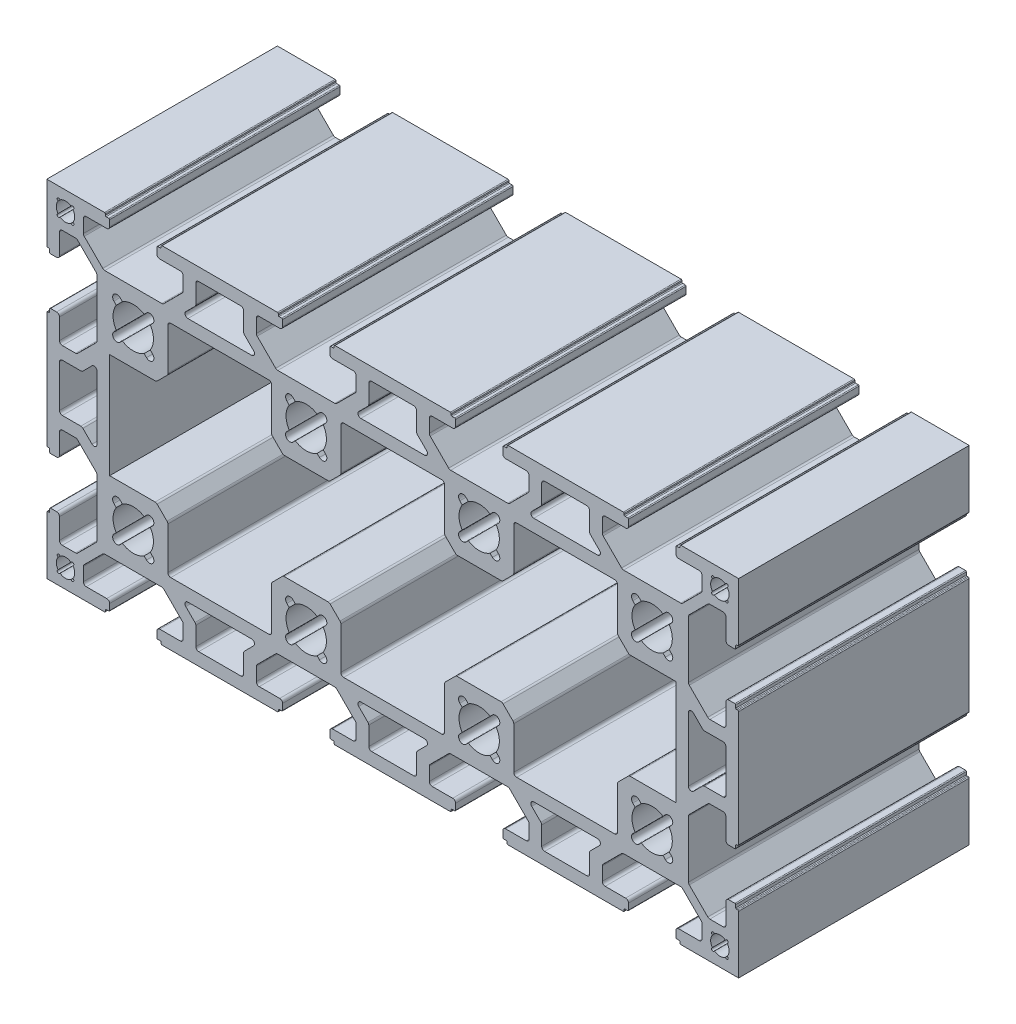
from build123d import *

# Parameters (mm, degrees)
Y_KSEKLIK_EKSTR_ZYON1_DEPTH = 40


with BuildPart() as part:
    # Çizim3 → Yükseklik-Ekstrüzyon1 (new body)
    with BuildSketch(Plane.XY):
        with BuildLine():
            Line((-10.9, 28.3), (-10.9, 29.35))
            ThreePointArc((-10.9, 29.35), (-10.856066017, 29.456066017), (-10.75, 29.5))
            Line((-10.75, 29.5), (-10.3, 29.5))
            ThreePointArc((-10.3, 29.5), (-10.193933983, 29.543933983), (-10.15, 29.65))
            Line((-10.15, 29.65), (-10.15, 29.85))
            ThreePointArc((-10.15, 29.85), (-10.106066017, 29.956066017), (-10, 30))
            Line((-10, 30), (10, 30))
            ThreePointArc((10, 30), (10.106066017, 29.956066017), (10.15, 29.85))
            Line((10.15, 29.85), (10.15, 29.65))
            ThreePointArc((10.15, 29.65), (10.193933983, 29.543933983), (10.3, 29.5))
            Line((10.3, 29.5), (10.75, 29.5))
            ThreePointArc((10.75, 29.5), (10.856066017, 29.456066017), (10.9, 29.35))
            Line((10.9, 29.35), (10.9, 28.3))
            ThreePointArc((10.9, 28.3), (10.753553391, 27.946446609), (10.4, 27.8))
            Line((10.4, 27.8), (6.85, 27.8))
            ThreePointArc((6.85, 27.8), (6.496446609, 27.653553391), (6.35, 27.3))
            Line((6.35, 27.3), (6.35, 25.007106781))
            ThreePointArc((6.35, 25.007106781), (6.388060234, 24.815765065), (6.496446609, 24.653553391))
            Line((6.496446609, 24.653553391), (9.703553391, 21.446446609))
            ThreePointArc((9.703553391, 21.446446609), (9.865765065, 21.338060234), (10.057106781, 21.3))
            Line((10.057106781, 21.3), (19.942893219, 21.3))
            ThreePointArc((19.942893219, 21.3), (20.134234935, 21.338060234), (20.296446609, 21.446446609))
            Line((20.296446609, 21.446446609), (23.503553391, 24.653553391))
            ThreePointArc((23.503553391, 24.653553391), (23.611939766, 24.815765065), (23.65, 25.007106781))
            Line((23.65, 25.007106781), (23.65, 27.3))
            ThreePointArc((23.65, 27.3), (23.503553391, 27.653553391), (23.15, 27.8))
            Line((23.15, 27.8), (19.6, 27.8))
            ThreePointArc((19.6, 27.8), (19.246446609, 27.946446609), (19.1, 28.3))
            Line((19.1, 28.3), (19.1, 29.35))
            ThreePointArc((19.1, 29.35), (19.143933983, 29.456066017), (19.25, 29.5))
            Line((19.25, 29.5), (19.7, 29.5))
            ThreePointArc((19.7, 29.5), (19.806066017, 29.543933983), (19.85, 29.65))
            Line((19.85, 29.65), (19.85, 29.85))
            ThreePointArc((19.85, 29.85), (19.893933983, 29.956066017), (20, 30))
            Line((20, 30), (40, 30))
            ThreePointArc((40, 30), (40.106066017, 29.956066017), (40.15, 29.85))
            Line((40.15, 29.85), (40.15, 29.65))
            ThreePointArc((40.15, 29.65), (40.193933983, 29.543933983), (40.3, 29.5))
            Line((40.3, 29.5), (40.75, 29.5))
            ThreePointArc((40.75, 29.5), (40.856066017, 29.456066017), (40.9, 29.35))
            Line((40.9, 29.35), (40.9, 28.3))
            ThreePointArc((40.9, 28.3), (40.753553391, 27.946446609), (40.4, 27.8))
            Line((40.4, 27.8), (36.85, 27.8))
            ThreePointArc((36.85, 27.8), (36.496446609, 27.653553391), (36.35, 27.3))
            Line((36.35, 27.3), (36.35, 25.007106781))
            ThreePointArc((36.35, 25.007106781), (36.388060234, 24.815765065), (36.496446609, 24.653553391))
            Line((36.496446609, 24.653553391), (39.703553391, 21.446446609))
            ThreePointArc((39.703553391, 21.446446609), (39.865765065, 21.338060234), (40.057106781, 21.3))
            Line((40.057106781, 21.3), (49.942893219, 21.3))
            ThreePointArc((49.942893219, 21.3), (50.134234935, 21.338060234), (50.296446609, 21.446446609))
            Line((50.296446609, 21.446446609), (53.503553391, 24.653553391))
            ThreePointArc((53.503553391, 24.653553391), (53.611939766, 24.815765065), (53.65, 25.007106781))
            Line((53.65, 25.007106781), (53.65, 27.3))
            ThreePointArc((53.65, 27.3), (53.503553391, 27.653553391), (53.15, 27.8))
            Line((53.15, 27.8), (49.6, 27.8))
            ThreePointArc((49.6, 27.8), (49.246446609, 27.946446609), (49.1, 28.3))
            Line((49.1, 28.3), (49.1, 29.35))
            ThreePointArc((49.1, 29.35), (49.143933983, 29.456066017), (49.25, 29.5))
            Line((49.25, 29.5), (49.7, 29.5))
            ThreePointArc((49.7, 29.5), (49.806066017, 29.543933983), (49.85, 29.65))
            Line((49.85, 29.65), (49.85, 29.85))
            ThreePointArc((49.85, 29.85), (49.893933983, 29.956066017), (50, 30))
            Line((50, 30), (60, 30))
            Line((60, 30), (60, 20))
            ThreePointArc((60, 20), (59.956066017, 19.893933983), (59.85, 19.85))
            Line((59.85, 19.85), (59.65, 19.85))
            ThreePointArc((59.65, 19.85), (59.543933983, 19.806066017), (59.5, 19.7))
            Line((59.5, 19.7), (59.5, 19.25))
            ThreePointArc((59.5, 19.25), (59.456066017, 19.143933983), (59.35, 19.1))
            Line((59.35, 19.1), (58.3, 19.1))
            ThreePointArc((58.3, 19.1), (57.946446609, 19.246446609), (57.8, 19.6))
            Line((57.8, 19.6), (57.8, 23.15))
            ThreePointArc((57.8, 23.15), (57.653553391, 23.503553391), (57.3, 23.65))
            Line((57.3, 23.65), (55.007106781, 23.65))
            ThreePointArc((55.007106781, 23.65), (54.815765065, 23.611939766), (54.653553391, 23.503553391))
            Line((54.653553391, 23.503553391), (51.446446609, 20.296446609))
            ThreePointArc((51.446446609, 20.296446609), (51.338060234, 20.134234935), (51.3, 19.942893219))
            Line((51.3, 19.942893219), (51.3, 10.057106781))
            ThreePointArc((51.3, 10.057106781), (51.338060234, 9.865765065), (51.446446609, 9.703553391))
            Line((51.446446609, 9.703553391), (54.653553391, 6.496446609))
            ThreePointArc((54.653553391, 6.496446609), (54.815765065, 6.388060234), (55.007106781, 6.35))
            Line((55.007106781, 6.35), (57.3, 6.35))
            ThreePointArc((57.3, 6.35), (57.653553391, 6.496446609), (57.8, 6.85))
            Line((57.8, 6.85), (57.8, 10.4))
            ThreePointArc((57.8, 10.4), (57.946446609, 10.753553391), (58.3, 10.9))
            Line((58.3, 10.9), (59.35, 10.9))
            ThreePointArc((59.35, 10.9), (59.456066017, 10.856066017), (59.5, 10.75))
            Line((59.5, 10.75), (59.5, 10.3))
            ThreePointArc((59.5, 10.3), (59.543933983, 10.193933983), (59.65, 10.15))
            Line((59.65, 10.15), (59.85, 10.15))
            ThreePointArc((59.85, 10.15), (59.956066017, 10.106066017), (60, 10))
            Line((60, 10), (60, -10))
            ThreePointArc((60, -10), (59.956066017, -10.106066017), (59.85, -10.15))
            Line((59.85, -10.15), (59.65, -10.15))
            ThreePointArc((59.65, -10.15), (59.543933983, -10.193933983), (59.5, -10.3))
            Line((59.5, -10.3), (59.5, -10.75))
            ThreePointArc((59.5, -10.75), (59.456066017, -10.856066017), (59.35, -10.9))
            Line((59.35, -10.9), (58.3, -10.9))
            ThreePointArc((58.3, -10.9), (57.946446609, -10.753553391), (57.8, -10.4))
            Line((57.8, -10.4), (57.8, -6.85))
            ThreePointArc((57.8, -6.85), (57.653553391, -6.496446609), (57.3, -6.35))
            Line((57.3, -6.35), (55.007106781, -6.35))
            ThreePointArc((55.007106781, -6.35), (54.815765065, -6.388060234), (54.653553391, -6.496446609))
            Line((54.653553391, -6.496446609), (51.446446609, -9.703553391))
            ThreePointArc((51.446446609, -9.703553391), (51.338060234, -9.865765065), (51.3, -10.057106781))
            Line((51.3, -10.057106781), (51.3, -19.942893219))
            ThreePointArc((51.3, -19.942893219), (51.338060234, -20.134234935), (51.446446609, -20.296446609))
            Line((51.446446609, -20.296446609), (54.653553391, -23.503553391))
            ThreePointArc((54.653553391, -23.503553391), (54.815765065, -23.611939766), (55.007106781, -23.65))
            Line((55.007106781, -23.65), (57.3, -23.65))
            ThreePointArc((57.3, -23.65), (57.653553391, -23.503553391), (57.8, -23.15))
            Line((57.8, -23.15), (57.8, -19.6))
            ThreePointArc((57.8, -19.6), (57.946446609, -19.246446609), (58.3, -19.1))
            Line((58.3, -19.1), (59.35, -19.1))
            ThreePointArc((59.35, -19.1), (59.456066017, -19.143933983), (59.5, -19.25))
            Line((59.5, -19.25), (59.5, -19.7))
            ThreePointArc((59.5, -19.7), (59.543933983, -19.806066017), (59.65, -19.85))
            Line((59.65, -19.85), (59.85, -19.85))
            ThreePointArc((59.85, -19.85), (59.956066017, -19.893933983), (60, -20))
            Line((60, -20), (60, -30))
            Line((60, -30), (50, -30))
            ThreePointArc((50, -30), (49.893933983, -29.956066017), (49.85, -29.85))
            Line((49.85, -29.85), (49.85, -29.65))
            ThreePointArc((49.85, -29.65), (49.806066017, -29.543933983), (49.7, -29.5))
            Line((49.7, -29.5), (49.25, -29.5))
            ThreePointArc((49.25, -29.5), (49.143933983, -29.456066017), (49.1, -29.35))
            Line((49.1, -29.35), (49.1, -28.3))
            ThreePointArc((49.1, -28.3), (49.246446609, -27.946446609), (49.6, -27.8))
            Line((49.6, -27.8), (53.15, -27.8))
            ThreePointArc((53.15, -27.8), (53.503553391, -27.653553391), (53.65, -27.3))
            Line((53.65, -27.3), (53.65, -25.007106781))
            ThreePointArc((53.65, -25.007106781), (53.611939766, -24.815765065), (53.503553391, -24.653553391))
            Line((53.503553391, -24.653553391), (50.296446609, -21.446446609))
            ThreePointArc((50.296446609, -21.446446609), (50.134234935, -21.338060234), (49.942893219, -21.3))
            Line((49.942893219, -21.3), (40.057106781, -21.3))
            ThreePointArc((40.057106781, -21.3), (39.865765065, -21.338060234), (39.703553391, -21.446446609))
            Line((39.703553391, -21.446446609), (36.496446609, -24.653553391))
            ThreePointArc((36.496446609, -24.653553391), (36.388060234, -24.815765065), (36.35, -25.007106781))
            Line((36.35, -25.007106781), (36.35, -27.3))
            ThreePointArc((36.35, -27.3), (36.496446609, -27.653553391), (36.85, -27.8))
            Line((36.85, -27.8), (40.4, -27.8))
            ThreePointArc((40.4, -27.8), (40.753553391, -27.946446609), (40.9, -28.3))
            Line((40.9, -28.3), (40.9, -29.35))
            ThreePointArc((40.9, -29.35), (40.856066017, -29.456066017), (40.75, -29.5))
            Line((40.75, -29.5), (40.3, -29.5))
            ThreePointArc((40.3, -29.5), (40.193933983, -29.543933983), (40.15, -29.65))
            Line((40.15, -29.65), (40.15, -29.85))
            ThreePointArc((40.15, -29.85), (40.106066017, -29.956066017), (40, -30))
            Line((40, -30), (20, -30))
            ThreePointArc((20, -30), (19.893933983, -29.956066017), (19.85, -29.85))
            Line((19.85, -29.85), (19.85, -29.65))
            ThreePointArc((19.85, -29.65), (19.806066017, -29.543933983), (19.7, -29.5))
            Line((19.7, -29.5), (19.25, -29.5))
            ThreePointArc((19.25, -29.5), (19.143933983, -29.456066017), (19.1, -29.35))
            Line((19.1, -29.35), (19.1, -28.3))
            ThreePointArc((19.1, -28.3), (19.246446609, -27.946446609), (19.6, -27.8))
            Line((19.6, -27.8), (23.15, -27.8))
            ThreePointArc((23.15, -27.8), (23.503553391, -27.653553391), (23.65, -27.3))
            Line((23.65, -27.3), (23.65, -25.007106781))
            ThreePointArc((23.65, -25.007106781), (23.611939766, -24.815765065), (23.503553391, -24.653553391))
            Line((23.503553391, -24.653553391), (20.296446609, -21.446446609))
            ThreePointArc((20.296446609, -21.446446609), (20.134234935, -21.338060234), (19.942893219, -21.3))
            Line((19.942893219, -21.3), (10.057106781, -21.3))
            ThreePointArc((10.057106781, -21.3), (9.865765065, -21.338060234), (9.703553391, -21.446446609))
            Line((9.703553391, -21.446446609), (6.496446609, -24.653553391))
            ThreePointArc((6.496446609, -24.653553391), (6.388060234, -24.815765065), (6.35, -25.007106781))
            Line((6.35, -25.007106781), (6.35, -27.3))
            ThreePointArc((6.35, -27.3), (6.496446609, -27.653553391), (6.85, -27.8))
            Line((6.85, -27.8), (10.4, -27.8))
            ThreePointArc((10.4, -27.8), (10.753553391, -27.946446609), (10.9, -28.3))
            Line((10.9, -28.3), (10.9, -29.35))
            ThreePointArc((10.9, -29.35), (10.856066017, -29.456066017), (10.75, -29.5))
            Line((10.75, -29.5), (10.3, -29.5))
            ThreePointArc((10.3, -29.5), (10.193933983, -29.543933983), (10.15, -29.65))
            Line((10.15, -29.65), (10.15, -29.85))
            ThreePointArc((10.15, -29.85), (10.106066017, -29.956066017), (10, -30))
            Line((10, -30), (-10, -30))
            ThreePointArc((-10, -30), (-10.106066017, -29.956066017), (-10.15, -29.85))
            Line((-10.15, -29.85), (-10.15, -29.65))
            ThreePointArc((-10.15, -29.65), (-10.193933983, -29.543933983), (-10.3, -29.5))
            Line((-10.3, -29.5), (-10.75, -29.5))
            ThreePointArc((-10.75, -29.5), (-10.856066017, -29.456066017), (-10.9, -29.35))
            Line((-10.9, -29.35), (-10.9, -28.3))
            ThreePointArc((-10.9, -28.3), (-10.753553391, -27.946446609), (-10.4, -27.8))
            Line((-10.4, -27.8), (-6.85, -27.8))
            ThreePointArc((-6.85, -27.8), (-6.496446609, -27.653553391), (-6.35, -27.3))
            Line((-6.35, -27.3), (-6.35, -25.007106781))
            ThreePointArc((-6.35, -25.007106781), (-6.388060234, -24.815765065), (-6.496446609, -24.653553391))
            Line((-6.496446609, -24.653553391), (-9.703553391, -21.446446609))
            ThreePointArc((-9.703553391, -21.446446609), (-9.865765065, -21.338060234), (-10.057106781, -21.3))
            Line((-10.057106781, -21.3), (-19.942893219, -21.3))
            ThreePointArc((-19.942893219, -21.3), (-20.134234935, -21.338060234), (-20.296446609, -21.446446609))
            Line((-20.296446609, -21.446446609), (-23.503553391, -24.653553391))
            ThreePointArc((-23.503553391, -24.653553391), (-23.611939766, -24.815765065), (-23.65, -25.007106781))
            Line((-23.65, -25.007106781), (-23.65, -27.3))
            ThreePointArc((-23.65, -27.3), (-23.503553391, -27.653553391), (-23.15, -27.8))
            Line((-23.15, -27.8), (-19.6, -27.8))
            ThreePointArc((-19.6, -27.8), (-19.246446609, -27.946446609), (-19.1, -28.3))
            Line((-19.1, -28.3), (-19.1, -29.35))
            ThreePointArc((-19.1, -29.35), (-19.143933983, -29.456066017), (-19.25, -29.5))
            Line((-19.25, -29.5), (-19.7, -29.5))
            ThreePointArc((-19.7, -29.5), (-19.806066017, -29.543933983), (-19.85, -29.65))
            Line((-19.85, -29.65), (-19.85, -29.85))
            ThreePointArc((-19.85, -29.85), (-19.893933983, -29.956066017), (-20, -30))
            Line((-20, -30), (-40, -30))
            ThreePointArc((-40, -30), (-40.106066017, -29.956066017), (-40.15, -29.85))
            Line((-40.15, -29.85), (-40.15, -29.65))
            ThreePointArc((-40.15, -29.65), (-40.193933983, -29.543933983), (-40.3, -29.5))
            Line((-40.3, -29.5), (-40.75, -29.5))
            ThreePointArc((-40.75, -29.5), (-40.856066017, -29.456066017), (-40.9, -29.35))
            Line((-40.9, -29.35), (-40.9, -28.3))
            ThreePointArc((-40.9, -28.3), (-40.753553391, -27.946446609), (-40.4, -27.8))
            Line((-40.4, -27.8), (-36.85, -27.8))
            ThreePointArc((-36.85, -27.8), (-36.496446609, -27.653553391), (-36.35, -27.3))
            Line((-36.35, -27.3), (-36.35, -25.007106781))
            ThreePointArc((-36.35, -25.007106781), (-36.388060234, -24.815765065), (-36.496446609, -24.653553391))
            Line((-36.496446609, -24.653553391), (-39.703553391, -21.446446609))
            ThreePointArc((-39.703553391, -21.446446609), (-39.865765065, -21.338060234), (-40.057106781, -21.3))
            Line((-40.057106781, -21.3), (-49.942893219, -21.3))
            ThreePointArc((-49.942893219, -21.3), (-50.134234935, -21.338060234), (-50.296446609, -21.446446609))
            Line((-50.296446609, -21.446446609), (-53.503553391, -24.653553391))
            ThreePointArc((-53.503553391, -24.653553391), (-53.611939766, -24.815765065), (-53.65, -25.007106781))
            Line((-53.65, -25.007106781), (-53.65, -27.3))
            ThreePointArc((-53.65, -27.3), (-53.503553391, -27.653553391), (-53.15, -27.8))
            Line((-53.15, -27.8), (-49.6, -27.8))
            ThreePointArc((-49.6, -27.8), (-49.246446609, -27.946446609), (-49.1, -28.3))
            Line((-49.1, -28.3), (-49.1, -29.35))
            ThreePointArc((-49.1, -29.35), (-49.143933983, -29.456066017), (-49.25, -29.5))
            Line((-49.25, -29.5), (-49.7, -29.5))
            ThreePointArc((-49.7, -29.5), (-49.806066017, -29.543933983), (-49.85, -29.65))
            Line((-49.85, -29.65), (-49.85, -29.85))
            ThreePointArc((-49.85, -29.85), (-49.893933983, -29.956066017), (-50, -30))
            Line((-50, -30), (-60, -30))
            Line((-60, -30), (-60, -20))
            ThreePointArc((-60, -20), (-59.956066017, -19.893933983), (-59.85, -19.85))
            Line((-59.85, -19.85), (-59.65, -19.85))
            ThreePointArc((-59.65, -19.85), (-59.543933983, -19.806066017), (-59.5, -19.7))
            Line((-59.5, -19.7), (-59.5, -19.25))
            ThreePointArc((-59.5, -19.25), (-59.456066017, -19.143933983), (-59.35, -19.1))
            Line((-59.35, -19.1), (-58.3, -19.1))
            ThreePointArc((-58.3, -19.1), (-57.946446609, -19.246446609), (-57.8, -19.6))
            Line((-57.8, -19.6), (-57.8, -23.15))
            ThreePointArc((-57.8, -23.15), (-57.653553391, -23.503553391), (-57.3, -23.65))
            Line((-57.3, -23.65), (-55.007106781, -23.65))
            ThreePointArc((-55.007106781, -23.65), (-54.815765065, -23.611939766), (-54.653553391, -23.503553391))
            Line((-54.653553391, -23.503553391), (-51.446446609, -20.296446609))
            ThreePointArc((-51.446446609, -20.296446609), (-51.338060234, -20.134234935), (-51.3, -19.942893219))
            Line((-51.3, -19.942893219), (-51.3, -10.057106781))
            ThreePointArc((-51.3, -10.057106781), (-51.338060234, -9.865765065), (-51.446446609, -9.703553391))
            Line((-51.446446609, -9.703553391), (-54.653553391, -6.496446609))
            ThreePointArc((-54.653553391, -6.496446609), (-54.815765065, -6.388060234), (-55.007106781, -6.35))
            Line((-55.007106781, -6.35), (-57.3, -6.35))
            ThreePointArc((-57.3, -6.35), (-57.653553391, -6.496446609), (-57.8, -6.85))
            Line((-57.8, -6.85), (-57.8, -10.4))
            ThreePointArc((-57.8, -10.4), (-57.946446609, -10.753553391), (-58.3, -10.9))
            Line((-58.3, -10.9), (-59.35, -10.9))
            ThreePointArc((-59.35, -10.9), (-59.456066017, -10.856066017), (-59.5, -10.75))
            Line((-59.5, -10.75), (-59.5, -10.3))
            ThreePointArc((-59.5, -10.3), (-59.543933983, -10.193933983), (-59.65, -10.15))
            Line((-59.65, -10.15), (-59.85, -10.15))
            ThreePointArc((-59.85, -10.15), (-59.956066017, -10.106066017), (-60, -10))
            Line((-60, -10), (-60, 10))
            ThreePointArc((-60, 10), (-59.956066017, 10.106066017), (-59.85, 10.15))
            Line((-59.85, 10.15), (-59.65, 10.15))
            ThreePointArc((-59.65, 10.15), (-59.543933983, 10.193933983), (-59.5, 10.3))
            Line((-59.5, 10.3), (-59.5, 10.75))
            ThreePointArc((-59.5, 10.75), (-59.456066017, 10.856066017), (-59.35, 10.9))
            Line((-59.35, 10.9), (-58.3, 10.9))
            ThreePointArc((-58.3, 10.9), (-57.946446609, 10.753553391), (-57.8, 10.4))
            Line((-57.8, 10.4), (-57.8, 6.85))
            ThreePointArc((-57.8, 6.85), (-57.653553391, 6.496446609), (-57.3, 6.35))
            Line((-57.3, 6.35), (-55.007106781, 6.35))
            ThreePointArc((-55.007106781, 6.35), (-54.815765065, 6.388060234), (-54.653553391, 6.496446609))
            Line((-54.653553391, 6.496446609), (-51.446446609, 9.703553391))
            ThreePointArc((-51.446446609, 9.703553391), (-51.338060234, 9.865765065), (-51.3, 10.057106781))
            Line((-51.3, 10.057106781), (-51.3, 19.942893219))
            ThreePointArc((-51.3, 19.942893219), (-51.338060234, 20.134234935), (-51.446446609, 20.296446609))
            Line((-51.446446609, 20.296446609), (-54.653553391, 23.503553391))
            ThreePointArc((-54.653553391, 23.503553391), (-54.815765065, 23.611939766), (-55.007106781, 23.65))
            Line((-55.007106781, 23.65), (-57.3, 23.65))
            ThreePointArc((-57.3, 23.65), (-57.653553391, 23.503553391), (-57.8, 23.15))
            Line((-57.8, 23.15), (-57.8, 19.6))
            ThreePointArc((-57.8, 19.6), (-57.946446609, 19.246446609), (-58.3, 19.1))
            Line((-58.3, 19.1), (-59.35, 19.1))
            ThreePointArc((-59.35, 19.1), (-59.456066017, 19.143933983), (-59.5, 19.25))
            Line((-59.5, 19.25), (-59.5, 19.7))
            ThreePointArc((-59.5, 19.7), (-59.543933983, 19.806066017), (-59.65, 19.85))
            Line((-59.65, 19.85), (-59.85, 19.85))
            ThreePointArc((-59.85, 19.85), (-59.956066017, 19.893933983), (-60, 20))
            Line((-60, 20), (-60, 30))
            Line((-60, 30), (-50, 30))
            ThreePointArc((-50, 30), (-49.893933983, 29.956066017), (-49.85, 29.85))
            Line((-49.85, 29.85), (-49.85, 29.65))
            ThreePointArc((-49.85, 29.65), (-49.806066017, 29.543933983), (-49.7, 29.5))
            Line((-49.7, 29.5), (-49.25, 29.5))
            ThreePointArc((-49.25, 29.5), (-49.143933983, 29.456066017), (-49.1, 29.35))
            Line((-49.1, 29.35), (-49.1, 28.3))
            ThreePointArc((-49.1, 28.3), (-49.246446609, 27.946446609), (-49.6, 27.8))
            Line((-49.6, 27.8), (-53.15, 27.8))
            ThreePointArc((-53.15, 27.8), (-53.503553391, 27.653553391), (-53.65, 27.3))
            Line((-53.65, 27.3), (-53.65, 25.007106781))
            ThreePointArc((-53.65, 25.007106781), (-53.611939766, 24.815765065), (-53.503553391, 24.653553391))
            Line((-53.503553391, 24.653553391), (-50.296446609, 21.446446609))
            ThreePointArc((-50.296446609, 21.446446609), (-50.134234935, 21.338060234), (-49.942893219, 21.3))
            Line((-49.942893219, 21.3), (-40.057106781, 21.3))
            ThreePointArc((-40.057106781, 21.3), (-39.865765065, 21.338060234), (-39.703553391, 21.446446609))
            Line((-39.703553391, 21.446446609), (-36.496446609, 24.653553391))
            ThreePointArc((-36.496446609, 24.653553391), (-36.388060234, 24.815765065), (-36.35, 25.007106781))
            Line((-36.35, 25.007106781), (-36.35, 27.3))
            ThreePointArc((-36.35, 27.3), (-36.496446609, 27.653553391), (-36.85, 27.8))
            Line((-36.85, 27.8), (-40.4, 27.8))
            ThreePointArc((-40.4, 27.8), (-40.753553391, 27.946446609), (-40.9, 28.3))
            Line((-40.9, 28.3), (-40.9, 29.35))
            ThreePointArc((-40.9, 29.35), (-40.856066017, 29.456066017), (-40.75, 29.5))
            Line((-40.75, 29.5), (-40.3, 29.5))
            ThreePointArc((-40.3, 29.5), (-40.193933983, 29.543933983), (-40.15, 29.65))
            Line((-40.15, 29.65), (-40.15, 29.85))
            ThreePointArc((-40.15, 29.85), (-40.106066017, 29.956066017), (-40, 30))
            Line((-40, 30), (-20, 30))
            ThreePointArc((-20, 30), (-19.893933983, 29.956066017), (-19.85, 29.85))
            Line((-19.85, 29.85), (-19.85, 29.65))
            ThreePointArc((-19.85, 29.65), (-19.806066017, 29.543933983), (-19.7, 29.5))
            Line((-19.7, 29.5), (-19.25, 29.5))
            ThreePointArc((-19.25, 29.5), (-19.143933983, 29.456066017), (-19.1, 29.35))
            Line((-19.1, 29.35), (-19.1, 28.3))
            ThreePointArc((-19.1, 28.3), (-19.246446609, 27.946446609), (-19.6, 27.8))
            Line((-19.6, 27.8), (-23.15, 27.8))
            ThreePointArc((-23.15, 27.8), (-23.503553391, 27.653553391), (-23.65, 27.3))
            Line((-23.65, 27.3), (-23.65, 25.007106781))
            ThreePointArc((-23.65, 25.007106781), (-23.611939766, 24.815765065), (-23.503553391, 24.653553391))
            Line((-23.503553391, 24.653553391), (-20.296446609, 21.446446609))
            ThreePointArc((-20.296446609, 21.446446609), (-20.134234935, 21.338060234), (-19.942893219, 21.3))
            Line((-19.942893219, 21.3), (-10.057106781, 21.3))
            ThreePointArc((-10.057106781, 21.3), (-9.865765065, 21.338060234), (-9.703553391, 21.446446609))
            Line((-9.703553391, 21.446446609), (-6.496446609, 24.653553391))
            ThreePointArc((-6.496446609, 24.653553391), (-6.388060234, 24.815765065), (-6.35, 25.007106781))
            Line((-6.35, 25.007106781), (-6.35, 27.3))
            ThreePointArc((-6.35, 27.3), (-6.496446609, 27.653553391), (-6.85, 27.8))
            Line((-6.85, 27.8), (-10.4, 27.8))
            ThreePointArc((-10.4, 27.8), (-10.753553391, 27.946446609), (-10.9, 28.3))
        make_face()
        with BuildLine():
            Line((5.531623382, 21.3), (-5.531623382, 21.3))
            ThreePointArc((-5.531623382, 21.3), (-5.993563148, 21.608658284), (-5.885176772, 22.153553391))
            Line((-5.885176772, 22.153553391), (-4.296446609, 23.742283553))
            ThreePointArc((-4.296446609, 23.742283553), (-4.188060234, 23.904495228), (-4.15, 24.095836944))
            Line((-4.15, 24.095836944), (-4.15, 27.3))
            ThreePointArc((-4.15, 27.3), (-4.003553391, 27.653553391), (-3.65, 27.8))
            Line((-3.65, 27.8), (3.65, 27.8))
            ThreePointArc((3.65, 27.8), (4.003553391, 27.653553391), (4.15, 27.3))
            Line((4.15, 27.3), (4.15, 24.095836944))
            ThreePointArc((4.15, 24.095836944), (4.188060234, 23.904495228), (4.296446609, 23.742283553))
            Line((4.296446609, 23.742283553), (5.885176772, 22.153553391))
            ThreePointArc((5.885176772, 22.153553391), (5.993563148, 21.608658284), (5.531623382, 21.3))
        make_face(mode=Mode.SUBTRACT)
        with BuildLine():
            Line((8.5, 19.1), (-8.5, 19.1))
            ThreePointArc((-8.5, 19.1), (-8.853553391, 18.953553391), (-9, 18.6))
            Line((-9, 18.6), (-9, 11.307106781))
            ThreePointArc((-9, 11.307106781), (-9.038060234, 11.115765065), (-9.146446609, 10.953553391))
            Line((-9.146446609, 10.953553391), (-10.853553391, 9.246446609))
            ThreePointArc((-10.853553391, 9.246446609), (-11.015765065, 9.138060234), (-11.207106781, 9.1))
            Line((-11.207106781, 9.1), (-18.792893219, 9.1))
            ThreePointArc((-18.792893219, 9.1), (-18.984234935, 9.138060234), (-19.146446609, 9.246446609))
            Line((-19.146446609, 9.246446609), (-20.853553391, 10.953553391))
            ThreePointArc((-20.853553391, 10.953553391), (-20.961939766, 11.115765065), (-21, 11.307106781))
            Line((-21, 11.307106781), (-21, 18.6))
            ThreePointArc((-21, 18.6), (-21.146446609, 18.953553391), (-21.5, 19.1))
            Line((-21.5, 19.1), (-38.5, 19.1))
            ThreePointArc((-38.5, 19.1), (-38.853553391, 18.953553391), (-39, 18.6))
            Line((-39, 18.6), (-39, 11.307106781))
            ThreePointArc((-39, 11.307106781), (-39.038060234, 11.115765065), (-39.146446609, 10.953553391))
            Line((-39.146446609, 10.953553391), (-40.853553391, 9.246446609))
            ThreePointArc((-40.853553391, 9.246446609), (-41.015765065, 9.138060234), (-41.207106781, 9.1))
            Line((-41.207106781, 9.1), (-49.1, 9.1))
            Line((-49.1, 9.1), (-49.1, -9.1))
            Line((-49.1, -9.1), (-41.207106781, -9.1))
            ThreePointArc((-41.207106781, -9.1), (-41.015765065, -9.138060234), (-40.853553391, -9.246446609))
            Line((-40.853553391, -9.246446609), (-39.146446609, -10.953553391))
            ThreePointArc((-39.146446609, -10.953553391), (-39.038060234, -11.115765065), (-39, -11.307106781))
            Line((-39, -11.307106781), (-39, -18.6))
            ThreePointArc((-39, -18.6), (-38.853553391, -18.953553391), (-38.5, -19.1))
            Line((-38.5, -19.1), (-21.5, -19.1))
            ThreePointArc((-21.5, -19.1), (-21.146446609, -18.953553391), (-21, -18.6))
            Line((-21, -18.6), (-21, -11.307106781))
            ThreePointArc((-21, -11.307106781), (-20.961939766, -11.115765065), (-20.853553391, -10.953553391))
            Line((-20.853553391, -10.953553391), (-19.146446609, -9.246446609))
            ThreePointArc((-19.146446609, -9.246446609), (-18.984234935, -9.138060234), (-18.792893219, -9.1))
            Line((-18.792893219, -9.1), (-11.207106781, -9.1))
            ThreePointArc((-11.207106781, -9.1), (-11.015765065, -9.138060234), (-10.853553391, -9.246446609))
            Line((-10.853553391, -9.246446609), (-9.146446609, -10.953553391))
            ThreePointArc((-9.146446609, -10.953553391), (-9.038060234, -11.115765065), (-9, -11.307106781))
            Line((-9, -11.307106781), (-9, -18.6))
            ThreePointArc((-9, -18.6), (-8.853553391, -18.953553391), (-8.5, -19.1))
            Line((-8.5, -19.1), (8.5, -19.1))
            ThreePointArc((8.5, -19.1), (8.853553391, -18.953553391), (9, -18.6))
            Line((9, -18.6), (9, -11.307106781))
            ThreePointArc((9, -11.307106781), (9.038060234, -11.115765065), (9.146446609, -10.953553391))
            Line((9.146446609, -10.953553391), (10.853553391, -9.246446609))
            ThreePointArc((10.853553391, -9.246446609), (11.015765065, -9.138060234), (11.207106781, -9.1))
            Line((11.207106781, -9.1), (18.792893219, -9.1))
            ThreePointArc((18.792893219, -9.1), (18.984234935, -9.138060234), (19.146446609, -9.246446609))
            Line((19.146446609, -9.246446609), (20.853553391, -10.953553391))
            ThreePointArc((20.853553391, -10.953553391), (20.961939766, -11.115765065), (21, -11.307106781))
            Line((21, -11.307106781), (21, -18.6))
            ThreePointArc((21, -18.6), (21.146446609, -18.953553391), (21.5, -19.1))
            Line((21.5, -19.1), (38.5, -19.1))
            ThreePointArc((38.5, -19.1), (38.853553391, -18.953553391), (39, -18.6))
            Line((39, -18.6), (39, -11.307106781))
            ThreePointArc((39, -11.307106781), (39.038060234, -11.115765065), (39.146446609, -10.953553391))
            Line((39.146446609, -10.953553391), (40.853553391, -9.246446609))
            ThreePointArc((40.853553391, -9.246446609), (41.015765065, -9.138060234), (41.207106781, -9.1))
            Line((41.207106781, -9.1), (49.1, -9.1))
            Line((49.1, -9.1), (49.1, 9.1))
            Line((49.1, 9.1), (41.207106781, 9.1))
            ThreePointArc((41.207106781, 9.1), (41.015765065, 9.138060234), (40.853553391, 9.246446609))
            Line((40.853553391, 9.246446609), (39.146446609, 10.953553391))
            ThreePointArc((39.146446609, 10.953553391), (39.038060234, 11.115765065), (39, 11.307106781))
            Line((39, 11.307106781), (39, 18.6))
            ThreePointArc((39, 18.6), (38.853553391, 18.953553391), (38.5, 19.1))
            Line((38.5, 19.1), (21.5, 19.1))
            ThreePointArc((21.5, 19.1), (21.146446609, 18.953553391), (21, 18.6))
            Line((21, 18.6), (21, 11.307106781))
            ThreePointArc((21, 11.307106781), (20.961939766, 11.115765065), (20.853553391, 10.953553391))
            Line((20.853553391, 10.953553391), (19.146446609, 9.246446609))
            ThreePointArc((19.146446609, 9.246446609), (18.984234935, 9.138060234), (18.792893219, 9.1))
            Line((18.792893219, 9.1), (11.207106781, 9.1))
            ThreePointArc((11.207106781, 9.1), (11.015765065, 9.138060234), (10.853553391, 9.246446609))
            Line((10.853553391, 9.246446609), (9.146446609, 10.953553391))
            ThreePointArc((9.146446609, 10.953553391), (9.038060234, 11.115765065), (9, 11.307106781))
            Line((9, 11.307106781), (9, 18.6))
            ThreePointArc((9, 18.6), (8.853553391, 18.953553391), (8.5, 19.1))
        make_face(mode=Mode.SUBTRACT)
        with BuildLine():
            Line((-26.35, 27.8), (-33.65, 27.8))
            ThreePointArc((-33.65, 27.8), (-34.003553391, 27.653553391), (-34.15, 27.3))
            Line((-34.15, 27.3), (-34.15, 24.095836944))
            ThreePointArc((-34.15, 24.095836944), (-34.188060234, 23.904495228), (-34.296446609, 23.742283553))
            Line((-34.296446609, 23.742283553), (-35.885176772, 22.153553391))
            ThreePointArc((-35.885176772, 22.153553391), (-35.993563148, 21.608658284), (-35.531623382, 21.3))
            Line((-35.531623382, 21.3), (-24.468376618, 21.3))
            ThreePointArc((-24.468376618, 21.3), (-24.006436852, 21.608658284), (-24.114823228, 22.153553391))
            Line((-24.114823228, 22.153553391), (-25.703553391, 23.742283553))
            ThreePointArc((-25.703553391, 23.742283553), (-25.811939766, 23.904495228), (-25.85, 24.095836944))
            Line((-25.85, 24.095836944), (-25.85, 27.3))
            ThreePointArc((-25.85, 27.3), (-25.996446609, 27.653553391), (-26.35, 27.8))
        make_face(mode=Mode.SUBTRACT)
        with BuildLine():
            Line((-54.095836944, 4.15), (-57.3, 4.15))
            ThreePointArc((-57.3, 4.15), (-57.653553391, 4.003553391), (-57.8, 3.65))
            Line((-57.8, 3.65), (-57.8, -3.65))
            ThreePointArc((-57.8, -3.65), (-57.653553391, -4.003553391), (-57.3, -4.15))
            Line((-57.3, -4.15), (-54.095836944, -4.15))
            ThreePointArc((-54.095836944, -4.15), (-53.904495228, -4.188060234), (-53.742283553, -4.296446609))
            Line((-53.742283553, -4.296446609), (-52.153553391, -5.885176772))
            ThreePointArc((-52.153553391, -5.885176772), (-51.608658284, -5.993563148), (-51.3, -5.531623382))
            Line((-51.3, -5.531623382), (-51.3, 5.531623382))
            ThreePointArc((-51.3, 5.531623382), (-51.608658284, 5.993563148), (-52.153553391, 5.885176772))
            Line((-52.153553391, 5.885176772), (-53.742283553, 4.296446609))
            ThreePointArc((-53.742283553, 4.296446609), (-53.904495228, 4.188060234), (-54.095836944, 4.15))
        make_face(mode=Mode.SUBTRACT)
        with BuildLine():
            Line((-43.112945135, 18.147715037), (-42.701902961, 18.558757211))
            ThreePointArc((-42.701902961, 18.558757211), (-41.641242789, 18.558757211), (-41.641242789, 17.498097039))
            Line((-41.641242789, 17.498097039), (-42.052284963, 17.087054865))
            ThreePointArc((-42.052284963, 17.087054865), (-41.5, 15.2), (-42.052284963, 13.312945135))
            Line((-42.052284963, 13.312945135), (-41.641242789, 12.901902961))
            ThreePointArc((-41.641242789, 12.901902961), (-41.641242789, 11.841242789), (-42.701902961, 11.841242789))
            Line((-42.701902961, 11.841242789), (-43.112945135, 12.252284963))
            ThreePointArc((-43.112945135, 12.252284963), (-45, 11.7), (-46.887054865, 12.252284963))
            Line((-46.887054865, 12.252284963), (-47.298097039, 11.841242789))
            ThreePointArc((-47.298097039, 11.841242789), (-48.358757211, 11.841242789), (-48.358757211, 12.901902961))
            Line((-48.358757211, 12.901902961), (-47.947715037, 13.312945135))
            ThreePointArc((-47.947715037, 13.312945135), (-48.5, 15.2), (-47.947715037, 17.087054865))
            Line((-47.947715037, 17.087054865), (-48.358757211, 17.498097039))
            ThreePointArc((-48.358757211, 17.498097039), (-48.358757211, 18.558757211), (-47.298097039, 18.558757211))
            Line((-47.298097039, 18.558757211), (-46.887054865, 18.147715037))
            ThreePointArc((-46.887054865, 18.147715037), (-45, 18.7), (-43.112945135, 18.147715037))
        make_face(mode=Mode.SUBTRACT)
        with BuildLine():
            Line((-12.052284963, 17.087054865), (-11.641242789, 17.498097039))
            ThreePointArc((-11.641242789, 17.498097039), (-11.641242789, 18.558757211), (-12.701902961, 18.558757211))
            Line((-12.701902961, 18.558757211), (-13.112945135, 18.147715037))
            ThreePointArc((-13.112945135, 18.147715037), (-15, 18.7), (-16.887054865, 18.147715037))
            Line((-16.887054865, 18.147715037), (-17.298097039, 18.558757211))
            ThreePointArc((-17.298097039, 18.558757211), (-18.358757211, 18.558757211), (-18.358757211, 17.498097039))
            Line((-18.358757211, 17.498097039), (-17.947715037, 17.087054865))
            ThreePointArc((-17.947715037, 17.087054865), (-18.5, 15.2), (-17.947715037, 13.312945135))
            Line((-17.947715037, 13.312945135), (-18.358757211, 12.901902961))
            ThreePointArc((-18.358757211, 12.901902961), (-18.358757211, 11.841242789), (-17.298097039, 11.841242789))
            Line((-17.298097039, 11.841242789), (-16.887054865, 12.252284963))
            ThreePointArc((-16.887054865, 12.252284963), (-15, 11.7), (-13.112945135, 12.252284963))
            Line((-13.112945135, 12.252284963), (-12.701902961, 11.841242789))
            ThreePointArc((-12.701902961, 11.841242789), (-11.641242789, 11.841242789), (-11.641242789, 12.901902961))
            Line((-11.641242789, 12.901902961), (-12.052284963, 13.312945135))
            ThreePointArc((-12.052284963, 13.312945135), (-11.5, 15.2), (-12.052284963, 17.087054865))
        make_face(mode=Mode.SUBTRACT)
        with BuildLine():
            Line((-58.044251527, 27.690698137), (-58.128858223, 27.775304833))
            ThreePointArc((-58.128858223, 27.775304833), (-58.128858223, 28.128858223), (-57.775304833, 28.128858223))
            Line((-57.775304833, 28.128858223), (-57.690698137, 28.044251527))
            ThreePointArc((-57.690698137, 28.044251527), (-56.75, 28.35), (-55.809301863, 28.044251527))
            Line((-55.809301863, 28.044251527), (-55.724695167, 28.128858223))
            ThreePointArc((-55.724695167, 28.128858223), (-55.371141777, 28.128858223), (-55.371141777, 27.775304833))
            Line((-55.371141777, 27.775304833), (-55.455748473, 27.690698137))
            ThreePointArc((-55.455748473, 27.690698137), (-55.15, 26.75), (-55.455748473, 25.809301863))
            Line((-55.455748473, 25.809301863), (-55.371141777, 25.724695167))
            ThreePointArc((-55.371141777, 25.724695167), (-55.371141777, 25.371141777), (-55.724695167, 25.371141777))
            Line((-55.724695167, 25.371141777), (-55.809301863, 25.455748473))
            ThreePointArc((-55.809301863, 25.455748473), (-56.75, 25.15), (-57.690698137, 25.455748473))
            Line((-57.690698137, 25.455748473), (-57.775304833, 25.371141777))
            ThreePointArc((-57.775304833, 25.371141777), (-58.128858223, 25.371141777), (-58.128858223, 25.724695167))
            Line((-58.128858223, 25.724695167), (-58.044251527, 25.809301863))
            ThreePointArc((-58.044251527, 25.809301863), (-58.35, 26.75), (-58.044251527, 27.690698137))
        make_face(mode=Mode.SUBTRACT)
        with BuildLine():
            Line((55.455748473, 25.809301863), (55.371141777, 25.724695167))
            ThreePointArc((55.371141777, 25.724695167), (55.371141777, 25.371141777), (55.724695167, 25.371141777))
            Line((55.724695167, 25.371141777), (55.809301863, 25.455748473))
            ThreePointArc((55.809301863, 25.455748473), (56.75, 25.15), (57.690698137, 25.455748473))
            Line((57.690698137, 25.455748473), (57.775304833, 25.371141777))
            ThreePointArc((57.775304833, 25.371141777), (58.128858223, 25.371141777), (58.128858223, 25.724695167))
            Line((58.128858223, 25.724695167), (58.044251527, 25.809301863))
            ThreePointArc((58.044251527, 25.809301863), (58.35, 26.75), (58.044251527, 27.690698137))
            Line((58.044251527, 27.690698137), (58.128858223, 27.775304833))
            ThreePointArc((58.128858223, 27.775304833), (58.128858223, 28.128858223), (57.775304833, 28.128858223))
            Line((57.775304833, 28.128858223), (57.690698137, 28.044251527))
            ThreePointArc((57.690698137, 28.044251527), (56.75, 28.35), (55.809301863, 28.044251527))
            Line((55.809301863, 28.044251527), (55.724695167, 28.128858223))
            ThreePointArc((55.724695167, 28.128858223), (55.371141777, 28.128858223), (55.371141777, 27.775304833))
            Line((55.371141777, 27.775304833), (55.455748473, 27.690698137))
            ThreePointArc((55.455748473, 27.690698137), (55.15, 26.75), (55.455748473, 25.809301863))
        make_face(mode=Mode.SUBTRACT)
        with BuildLine():
            Line((35.885176772, 22.153553391), (34.296446609, 23.742283553))
            ThreePointArc((34.296446609, 23.742283553), (34.188060234, 23.904495228), (34.15, 24.095836944))
            Line((34.15, 24.095836944), (34.15, 27.3))
            ThreePointArc((34.15, 27.3), (34.003553391, 27.653553391), (33.65, 27.8))
            Line((33.65, 27.8), (26.35, 27.8))
            ThreePointArc((26.35, 27.8), (25.996446609, 27.653553391), (25.85, 27.3))
            Line((25.85, 27.3), (25.85, 24.095836944))
            ThreePointArc((25.85, 24.095836944), (25.811939766, 23.904495228), (25.703553391, 23.742283553))
            Line((25.703553391, 23.742283553), (24.114823228, 22.153553391))
            ThreePointArc((24.114823228, 22.153553391), (24.006436852, 21.608658284), (24.468376618, 21.3))
            Line((24.468376618, 21.3), (35.531623382, 21.3))
            ThreePointArc((35.531623382, 21.3), (35.993563148, 21.608658284), (35.885176772, 22.153553391))
        make_face(mode=Mode.SUBTRACT)
        with BuildLine():
            Line((11.641242789, 12.901902961), (12.052284963, 13.312945135))
            ThreePointArc((12.052284963, 13.312945135), (11.5, 15.2), (12.052284963, 17.087054865))
            Line((12.052284963, 17.087054865), (11.641242789, 17.498097039))
            ThreePointArc((11.641242789, 17.498097039), (11.641242789, 18.558757211), (12.701902961, 18.558757211))
            Line((12.701902961, 18.558757211), (13.112945135, 18.147715037))
            ThreePointArc((13.112945135, 18.147715037), (15, 18.7), (16.887054865, 18.147715037))
            Line((16.887054865, 18.147715037), (17.298097039, 18.558757211))
            ThreePointArc((17.298097039, 18.558757211), (18.358757211, 18.558757211), (18.358757211, 17.498097039))
            Line((18.358757211, 17.498097039), (17.947715037, 17.087054865))
            ThreePointArc((17.947715037, 17.087054865), (18.5, 15.2), (17.947715037, 13.312945135))
            Line((17.947715037, 13.312945135), (18.358757211, 12.901902961))
            ThreePointArc((18.358757211, 12.901902961), (18.358757211, 11.841242789), (17.298097039, 11.841242789))
            Line((17.298097039, 11.841242789), (16.887054865, 12.252284963))
            ThreePointArc((16.887054865, 12.252284963), (15, 11.7), (13.112945135, 12.252284963))
            Line((13.112945135, 12.252284963), (12.701902961, 11.841242789))
            ThreePointArc((12.701902961, 11.841242789), (11.641242789, 11.841242789), (11.641242789, 12.901902961))
        make_face(mode=Mode.SUBTRACT)
        with BuildLine():
            Line((47.947715037, 17.087054865), (48.358757211, 17.498097039))
            ThreePointArc((48.358757211, 17.498097039), (48.358757211, 18.558757211), (47.298097039, 18.558757211))
            Line((47.298097039, 18.558757211), (46.887054865, 18.147715037))
            ThreePointArc((46.887054865, 18.147715037), (45, 18.7), (43.112945135, 18.147715037))
            Line((43.112945135, 18.147715037), (42.701902961, 18.558757211))
            ThreePointArc((42.701902961, 18.558757211), (41.641242789, 18.558757211), (41.641242789, 17.498097039))
            Line((41.641242789, 17.498097039), (42.052284963, 17.087054865))
            ThreePointArc((42.052284963, 17.087054865), (41.5, 15.2), (42.052284963, 13.312945135))
            Line((42.052284963, 13.312945135), (41.641242789, 12.901902961))
            ThreePointArc((41.641242789, 12.901902961), (41.641242789, 11.841242789), (42.701902961, 11.841242789))
            Line((42.701902961, 11.841242789), (43.112945135, 12.252284963))
            ThreePointArc((43.112945135, 12.252284963), (45, 11.7), (46.887054865, 12.252284963))
            Line((46.887054865, 12.252284963), (47.298097039, 11.841242789))
            ThreePointArc((47.298097039, 11.841242789), (48.358757211, 11.841242789), (48.358757211, 12.901902961))
            Line((48.358757211, 12.901902961), (47.947715037, 13.312945135))
            ThreePointArc((47.947715037, 13.312945135), (48.5, 15.2), (47.947715037, 17.087054865))
        make_face(mode=Mode.SUBTRACT)
        with BuildLine():
            Line((57.8, 3.65), (57.8, -3.65))
            ThreePointArc((57.8, -3.65), (57.653553391, -4.003553391), (57.3, -4.15))
            Line((57.3, -4.15), (54.095836944, -4.15))
            ThreePointArc((54.095836944, -4.15), (53.904495228, -4.188060234), (53.742283553, -4.296446609))
            Line((53.742283553, -4.296446609), (52.153553391, -5.885176772))
            ThreePointArc((52.153553391, -5.885176772), (51.608658284, -5.993563148), (51.3, -5.531623382))
            Line((51.3, -5.531623382), (51.3, 5.531623382))
            ThreePointArc((51.3, 5.531623382), (51.608658284, 5.993563148), (52.153553391, 5.885176772))
            Line((52.153553391, 5.885176772), (53.742283553, 4.296446609))
            ThreePointArc((53.742283553, 4.296446609), (53.904495228, 4.188060234), (54.095836944, 4.15))
            Line((54.095836944, 4.15), (57.3, 4.15))
            ThreePointArc((57.3, 4.15), (57.653553391, 4.003553391), (57.8, 3.65))
        make_face(mode=Mode.SUBTRACT)
        with BuildLine():
            Line((55.371141777, -27.775304833), (55.455748473, -27.690698137))
            ThreePointArc((55.455748473, -27.690698137), (55.15, -26.75), (55.455748473, -25.809301863))
            Line((55.455748473, -25.809301863), (55.371141777, -25.724695167))
            ThreePointArc((55.371141777, -25.724695167), (55.371141777, -25.371141777), (55.724695167, -25.371141777))
            Line((55.724695167, -25.371141777), (55.809301863, -25.455748473))
            ThreePointArc((55.809301863, -25.455748473), (56.75, -25.15), (57.690698137, -25.455748473))
            Line((57.690698137, -25.455748473), (57.775304833, -25.371141777))
            ThreePointArc((57.775304833, -25.371141777), (58.128858223, -25.371141777), (58.128858223, -25.724695167))
            Line((58.128858223, -25.724695167), (58.044251527, -25.809301863))
            ThreePointArc((58.044251527, -25.809301863), (58.35, -26.75), (58.044251527, -27.690698137))
            Line((58.044251527, -27.690698137), (58.128858223, -27.775304833))
            ThreePointArc((58.128858223, -27.775304833), (58.128858223, -28.128858223), (57.775304833, -28.128858223))
            Line((57.775304833, -28.128858223), (57.690698137, -28.044251527))
            ThreePointArc((57.690698137, -28.044251527), (56.75, -28.35), (55.809301863, -28.044251527))
            Line((55.809301863, -28.044251527), (55.724695167, -28.128858223))
            ThreePointArc((55.724695167, -28.128858223), (55.371141777, -28.128858223), (55.371141777, -27.775304833))
        make_face(mode=Mode.SUBTRACT)
        with BuildLine():
            Line((48.358757211, -12.901902961), (47.947715037, -13.312945135))
            ThreePointArc((47.947715037, -13.312945135), (48.5, -15.2), (47.947715037, -17.087054865))
            Line((47.947715037, -17.087054865), (48.358757211, -17.498097039))
            ThreePointArc((48.358757211, -17.498097039), (48.358757211, -18.558757211), (47.298097039, -18.558757211))
            Line((47.298097039, -18.558757211), (46.887054865, -18.147715037))
            ThreePointArc((46.887054865, -18.147715037), (45, -18.7), (43.112945135, -18.147715037))
            Line((43.112945135, -18.147715037), (42.701902961, -18.558757211))
            ThreePointArc((42.701902961, -18.558757211), (41.641242789, -18.558757211), (41.641242789, -17.498097039))
            Line((41.641242789, -17.498097039), (42.052284963, -17.087054865))
            ThreePointArc((42.052284963, -17.087054865), (41.5, -15.2), (42.052284963, -13.312945135))
            Line((42.052284963, -13.312945135), (41.641242789, -12.901902961))
            ThreePointArc((41.641242789, -12.901902961), (41.641242789, -11.841242789), (42.701902961, -11.841242789))
            Line((42.701902961, -11.841242789), (43.112945135, -12.252284963))
            ThreePointArc((43.112945135, -12.252284963), (45, -11.7), (46.887054865, -12.252284963))
            Line((46.887054865, -12.252284963), (47.298097039, -11.841242789))
            ThreePointArc((47.298097039, -11.841242789), (48.358757211, -11.841242789), (48.358757211, -12.901902961))
        make_face(mode=Mode.SUBTRACT)
        with BuildLine():
            Line((35.531623382, -21.3), (24.468376618, -21.3))
            ThreePointArc((24.468376618, -21.3), (24.006436852, -21.608658284), (24.114823228, -22.153553391))
            Line((24.114823228, -22.153553391), (25.703553391, -23.742283553))
            ThreePointArc((25.703553391, -23.742283553), (25.811939766, -23.904495228), (25.85, -24.095836944))
            Line((25.85, -24.095836944), (25.85, -27.3))
            ThreePointArc((25.85, -27.3), (25.996446609, -27.653553391), (26.35, -27.8))
            Line((26.35, -27.8), (33.65, -27.8))
            ThreePointArc((33.65, -27.8), (34.003553391, -27.653553391), (34.15, -27.3))
            Line((34.15, -27.3), (34.15, -24.095836944))
            ThreePointArc((34.15, -24.095836944), (34.188060234, -23.904495228), (34.296446609, -23.742283553))
            Line((34.296446609, -23.742283553), (35.885176772, -22.153553391))
            ThreePointArc((35.885176772, -22.153553391), (35.993563148, -21.608658284), (35.531623382, -21.3))
        make_face(mode=Mode.SUBTRACT)
        with BuildLine():
            Line((12.052284963, -17.087054865), (11.641242789, -17.498097039))
            ThreePointArc((11.641242789, -17.498097039), (11.641242789, -18.558757211), (12.701902961, -18.558757211))
            Line((12.701902961, -18.558757211), (13.112945135, -18.147715037))
            ThreePointArc((13.112945135, -18.147715037), (15, -18.7), (16.887054865, -18.147715037))
            Line((16.887054865, -18.147715037), (17.298097039, -18.558757211))
            ThreePointArc((17.298097039, -18.558757211), (18.358757211, -18.558757211), (18.358757211, -17.498097039))
            Line((18.358757211, -17.498097039), (17.947715037, -17.087054865))
            ThreePointArc((17.947715037, -17.087054865), (18.5, -15.2), (17.947715037, -13.312945135))
            Line((17.947715037, -13.312945135), (18.358757211, -12.901902961))
            ThreePointArc((18.358757211, -12.901902961), (18.358757211, -11.841242789), (17.298097039, -11.841242789))
            Line((17.298097039, -11.841242789), (16.887054865, -12.252284963))
            ThreePointArc((16.887054865, -12.252284963), (15, -11.7), (13.112945135, -12.252284963))
            Line((13.112945135, -12.252284963), (12.701902961, -11.841242789))
            ThreePointArc((12.701902961, -11.841242789), (11.641242789, -11.841242789), (11.641242789, -12.901902961))
            Line((11.641242789, -12.901902961), (12.052284963, -13.312945135))
            ThreePointArc((12.052284963, -13.312945135), (11.5, -15.2), (12.052284963, -17.087054865))
        make_face(mode=Mode.SUBTRACT)
        with BuildLine():
            Line((5.885176772, -22.153553391), (4.296446609, -23.742283553))
            ThreePointArc((4.296446609, -23.742283553), (4.188060234, -23.904495228), (4.15, -24.095836944))
            Line((4.15, -24.095836944), (4.15, -27.3))
            ThreePointArc((4.15, -27.3), (4.003553391, -27.653553391), (3.65, -27.8))
            Line((3.65, -27.8), (-3.65, -27.8))
            ThreePointArc((-3.65, -27.8), (-4.003553391, -27.653553391), (-4.15, -27.3))
            Line((-4.15, -27.3), (-4.15, -24.095836944))
            ThreePointArc((-4.15, -24.095836944), (-4.188060234, -23.904495228), (-4.296446609, -23.742283553))
            Line((-4.296446609, -23.742283553), (-5.885176772, -22.153553391))
            ThreePointArc((-5.885176772, -22.153553391), (-5.993563148, -21.608658284), (-5.531623382, -21.3))
            Line((-5.531623382, -21.3), (5.531623382, -21.3))
            ThreePointArc((5.531623382, -21.3), (5.993563148, -21.608658284), (5.885176772, -22.153553391))
        make_face(mode=Mode.SUBTRACT)
        with BuildLine():
            Line((-11.641242789, -12.901902961), (-12.052284963, -13.312945135))
            ThreePointArc((-12.052284963, -13.312945135), (-11.5, -15.2), (-12.052284963, -17.087054865))
            Line((-12.052284963, -17.087054865), (-11.641242789, -17.498097039))
            ThreePointArc((-11.641242789, -17.498097039), (-11.641242789, -18.558757211), (-12.701902961, -18.558757211))
            Line((-12.701902961, -18.558757211), (-13.112945135, -18.147715037))
            ThreePointArc((-13.112945135, -18.147715037), (-15, -18.7), (-16.887054865, -18.147715037))
            Line((-16.887054865, -18.147715037), (-17.298097039, -18.558757211))
            ThreePointArc((-17.298097039, -18.558757211), (-18.358757211, -18.558757211), (-18.358757211, -17.498097039))
            Line((-18.358757211, -17.498097039), (-17.947715037, -17.087054865))
            ThreePointArc((-17.947715037, -17.087054865), (-18.5, -15.2), (-17.947715037, -13.312945135))
            Line((-17.947715037, -13.312945135), (-18.358757211, -12.901902961))
            ThreePointArc((-18.358757211, -12.901902961), (-18.358757211, -11.841242789), (-17.298097039, -11.841242789))
            Line((-17.298097039, -11.841242789), (-16.887054865, -12.252284963))
            ThreePointArc((-16.887054865, -12.252284963), (-15, -11.7), (-13.112945135, -12.252284963))
            Line((-13.112945135, -12.252284963), (-12.701902961, -11.841242789))
            ThreePointArc((-12.701902961, -11.841242789), (-11.641242789, -11.841242789), (-11.641242789, -12.901902961))
        make_face(mode=Mode.SUBTRACT)
        with BuildLine():
            Line((-35.885176772, -22.153553391), (-34.296446609, -23.742283553))
            ThreePointArc((-34.296446609, -23.742283553), (-34.188060234, -23.904495228), (-34.15, -24.095836944))
            Line((-34.15, -24.095836944), (-34.15, -27.3))
            ThreePointArc((-34.15, -27.3), (-34.003553391, -27.653553391), (-33.65, -27.8))
            Line((-33.65, -27.8), (-26.35, -27.8))
            ThreePointArc((-26.35, -27.8), (-25.996446609, -27.653553391), (-25.85, -27.3))
            Line((-25.85, -27.3), (-25.85, -24.095836944))
            ThreePointArc((-25.85, -24.095836944), (-25.811939766, -23.904495228), (-25.703553391, -23.742283553))
            Line((-25.703553391, -23.742283553), (-24.114823228, -22.153553391))
            ThreePointArc((-24.114823228, -22.153553391), (-24.006436852, -21.608658284), (-24.468376618, -21.3))
            Line((-24.468376618, -21.3), (-35.531623382, -21.3))
            ThreePointArc((-35.531623382, -21.3), (-35.993563148, -21.608658284), (-35.885176772, -22.153553391))
        make_face(mode=Mode.SUBTRACT)
        with BuildLine():
            Line((-47.947715037, -17.087054865), (-48.358757211, -17.498097039))
            ThreePointArc((-48.358757211, -17.498097039), (-48.358757211, -18.558757211), (-47.298097039, -18.558757211))
            Line((-47.298097039, -18.558757211), (-46.887054865, -18.147715037))
            ThreePointArc((-46.887054865, -18.147715037), (-45, -18.7), (-43.112945135, -18.147715037))
            Line((-43.112945135, -18.147715037), (-42.701902961, -18.558757211))
            ThreePointArc((-42.701902961, -18.558757211), (-41.641242789, -18.558757211), (-41.641242789, -17.498097039))
            Line((-41.641242789, -17.498097039), (-42.052284963, -17.087054865))
            ThreePointArc((-42.052284963, -17.087054865), (-41.5, -15.2), (-42.052284963, -13.312945135))
            Line((-42.052284963, -13.312945135), (-41.641242789, -12.901902961))
            ThreePointArc((-41.641242789, -12.901902961), (-41.641242789, -11.841242789), (-42.701902961, -11.841242789))
            Line((-42.701902961, -11.841242789), (-43.112945135, -12.252284963))
            ThreePointArc((-43.112945135, -12.252284963), (-45, -11.7), (-46.887054865, -12.252284963))
            Line((-46.887054865, -12.252284963), (-47.298097039, -11.841242789))
            ThreePointArc((-47.298097039, -11.841242789), (-48.358757211, -11.841242789), (-48.358757211, -12.901902961))
            Line((-48.358757211, -12.901902961), (-47.947715037, -13.312945135))
            ThreePointArc((-47.947715037, -13.312945135), (-48.5, -15.2), (-47.947715037, -17.087054865))
        make_face(mode=Mode.SUBTRACT)
        with BuildLine():
            Line((-55.455748473, -25.809301863), (-55.371141777, -25.724695167))
            ThreePointArc((-55.371141777, -25.724695167), (-55.371141777, -25.371141777), (-55.724695167, -25.371141777))
            Line((-55.724695167, -25.371141777), (-55.809301863, -25.455748473))
            ThreePointArc((-55.809301863, -25.455748473), (-56.75, -25.15), (-57.690698137, -25.455748473))
            Line((-57.690698137, -25.455748473), (-57.775304833, -25.371141777))
            ThreePointArc((-57.775304833, -25.371141777), (-58.128858223, -25.371141777), (-58.128858223, -25.724695167))
            Line((-58.128858223, -25.724695167), (-58.044251527, -25.809301863))
            ThreePointArc((-58.044251527, -25.809301863), (-58.35, -26.75), (-58.044251527, -27.690698137))
            Line((-58.044251527, -27.690698137), (-58.128858223, -27.775304833))
            ThreePointArc((-58.128858223, -27.775304833), (-58.128858223, -28.128858223), (-57.775304833, -28.128858223))
            Line((-57.775304833, -28.128858223), (-57.690698137, -28.044251527))
            ThreePointArc((-57.690698137, -28.044251527), (-56.75, -28.35), (-55.809301863, -28.044251527))
            Line((-55.809301863, -28.044251527), (-55.724695167, -28.128858223))
            ThreePointArc((-55.724695167, -28.128858223), (-55.371141777, -28.128858223), (-55.371141777, -27.775304833))
            Line((-55.371141777, -27.775304833), (-55.455748473, -27.690698137))
            ThreePointArc((-55.455748473, -27.690698137), (-55.15, -26.75), (-55.455748473, -25.809301863))
        make_face(mode=Mode.SUBTRACT)
    extrude(amount=-Y_KSEKLIK_EKSTR_ZYON1_DEPTH)


solid = part.part
